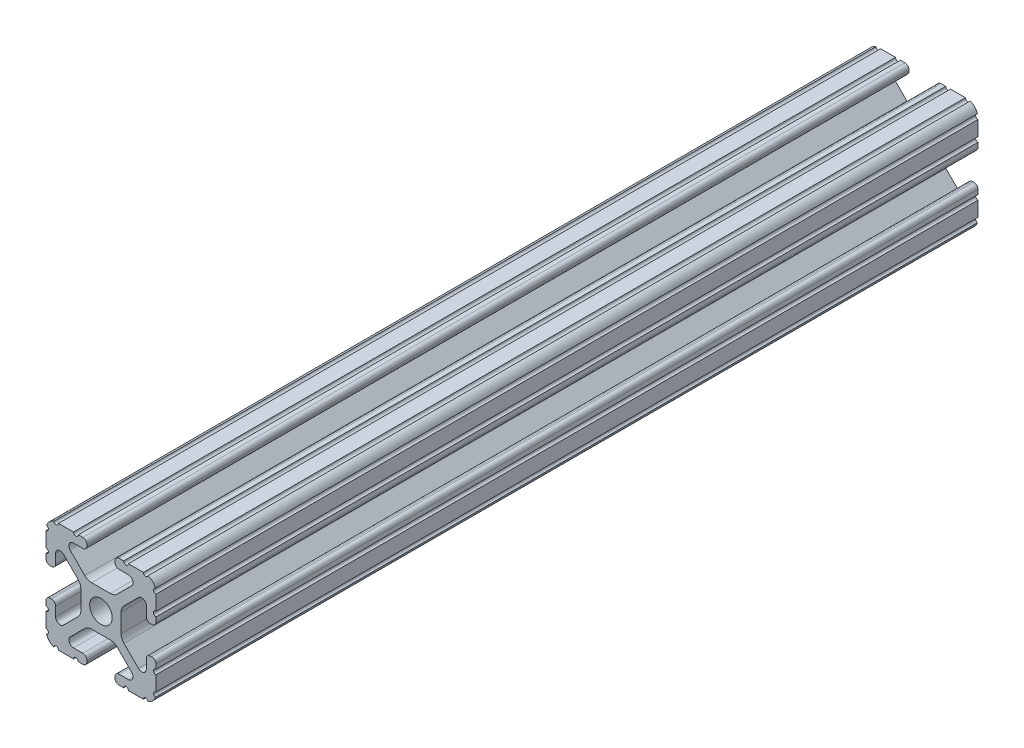
from build123d import *

# Parameters (mm, degrees)
BOSS_EXTRUDE1_START     = -94.996062
BOSS_EXTRUDE1_DEPTH     = 189.992124
CUT_EXTRUDE1_DEPTH      = 97.679014246
CUT_EXTRUDE1_DEPTH_BACK = 97.679014246
SKETCH5_R               = 0.55245


with BuildPart() as part:
    # Sketch4 → Boss-Extrude1 (new body)
    with BuildSketch(Plane.XY.offset(BOSS_EXTRUDE1_START)):
        with BuildLine():
            Line((4.190365, -12.7), (10.11729625, -12.7))
            ThreePointArc((10.11729625, -12.7), (11.943543585, -11.943543585), (12.7, -10.11729625))
            Line((12.7, -10.11729625), (12.7, -4.190365))
            ThreePointArc((12.7, -4.190365), (12.42492494, -3.52627506), (11.760835, -3.2512))
            Line((11.760835, -3.2512), (11.429365, -3.2512))
            ThreePointArc((11.429365, -3.2512), (10.76527506, -3.52627506), (10.4902, -4.190365))
            Line((10.4902, -4.190365), (10.4902, -6.348478019))
            ThreePointArc((10.4902, -6.348478019), (9.830707141, -7.335478831), (8.666460301, -7.103895736))
            Line((8.666460301, -7.103895736), (5.299899128, -3.737334563))
            ThreePointArc((5.299899128, -3.737334563), (4.817571085, -3.015479634), (4.6482, -2.16399369))
            Line((4.6482, -2.16399369), (4.6482, 0))
            Line((4.6482, 0), (2.6035, 0))
            ThreePointArc((2.6035, 0), (1.840952505, -1.840952505), (0, -2.6035))
            Line((0, -2.6035), (0, -4.6482))
            Line((0, -4.6482), (2.16399369, -4.6482))
            ThreePointArc((2.16399369, -4.6482), (3.015479634, -4.817571085), (3.737334563, -5.299899128))
            Line((3.737334563, -5.299899128), (7.103895736, -8.666460301))
            ThreePointArc((7.103895736, -8.666460301), (7.335478831, -9.830707141), (6.348478019, -10.4902))
            Line((6.348478019, -10.4902), (4.190365, -10.4902))
            ThreePointArc((4.190365, -10.4902), (3.52627506, -10.76527506), (3.2512, -11.429365))
            Line((3.2512, -11.429365), (3.2512, -11.760835))
            ThreePointArc((3.2512, -11.760835), (3.52627506, -12.42492494), (4.190365, -12.7))
        make_face()
    extrude(amount=BOSS_EXTRUDE1_DEPTH)

    # Sketch5 → Cut-Extrude1 (cut, two sides: drawn at the far end of the back side and taken through both)
    with BuildSketch(Plane.XY.offset(-CUT_EXTRUDE1_DEPTH_BACK)):
        with Locations((10.356153152, -12.7)):
            Circle(SKETCH5_R)
        with Locations((5.796028019, -12.7)):
            Circle(SKETCH5_R)
        with Locations((12.7, -10.356153152)):
            Circle(SKETCH5_R)
        with Locations((12.7, -5.796028019)):
            Circle(SKETCH5_R)
    extrude(amount=CUT_EXTRUDE1_DEPTH + CUT_EXTRUDE1_DEPTH_BACK, mode=Mode.SUBTRACT)

    # Mirror1: part across plane


with BuildPart() as part_1:
    add(part.part)
    add(part.part.mirror(Plane(origin=(0, 0, 0), x_dir=(0, 0, 1), z_dir=(1, 0, 0))))

    # Mirror2: part across plane


with BuildPart() as part_2:
    add(part_1.part)
    add(part_1.part.mirror(Plane.ZX))


solid = part_2.part
